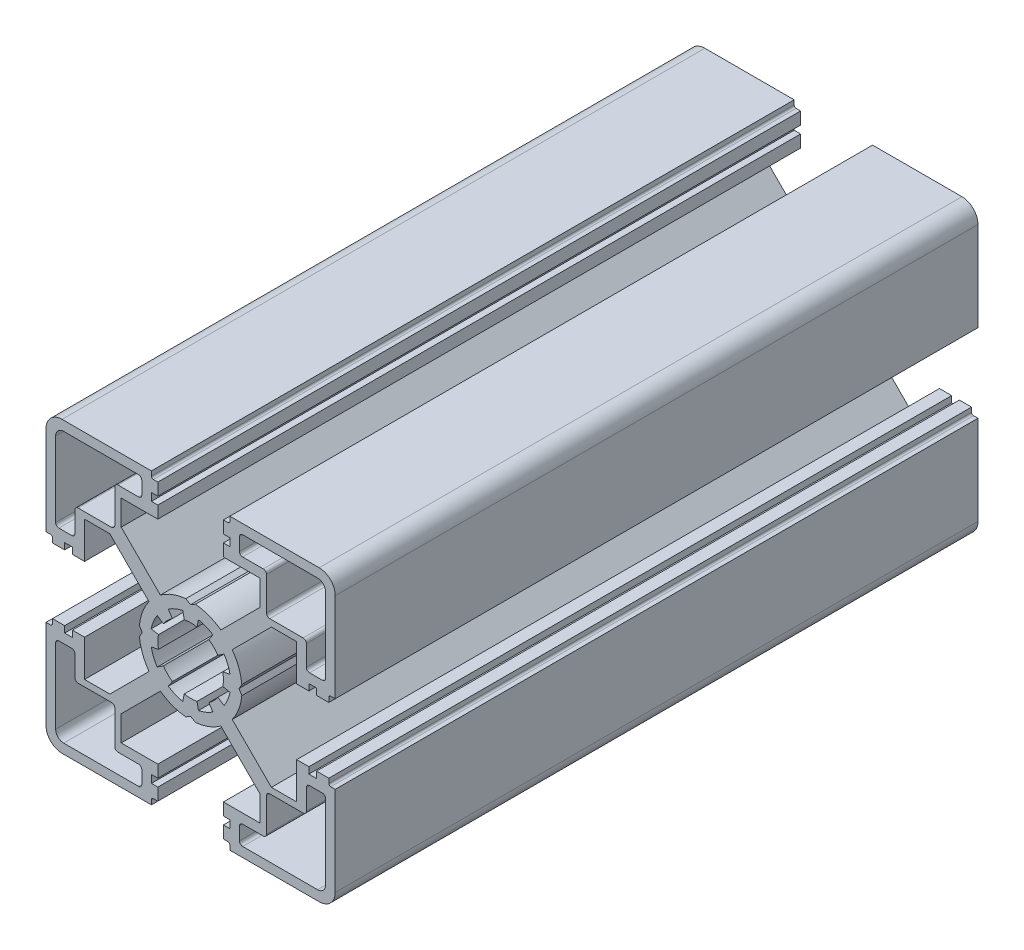
from build123d import *

# Parameters (mm, degrees)
EXTRUDE_1_DEPTH = 100


with BuildPart() as part:
    # 草图1 → 凸台-拉伸1 (new body)
    with BuildSketch(Plane.XY):
        with BuildLine():
            Line((-5.371587854, 21.742987377), (-19.271587854, 21.742987377))
            ThreePointArc((-19.271587854, 21.742987377), (-21.039354807, 21.01075433), (-21.771587854, 19.242987377))
            Line((-21.771587854, 19.242987377), (-21.771587854, 5.342987377))
            Line((-21.771587854, 5.342987377), (-21.071587854, 5.342987377))
            ThreePointArc((-21.071587854, 5.342987377), (-20.85945582, 5.255119412), (-20.771587854, 5.042987377))
            Line((-20.771587854, 5.042987377), (-20.771587854, 4.342987377))
            Line((-20.771587854, 4.342987377), (-18.871587854, 4.342987377))
            Line((-18.871587854, 4.342987377), (-18.871587854, 5.342987377))
            Line((-18.871587854, 5.342987377), (-17.671587854, 5.342987377))
            Line((-17.671587854, 5.342987377), (-17.671587854, 4.342987377))
            Line((-17.671587854, 4.342987377), (-15.771587854, 4.342987377))
            Line((-15.771587854, 4.342987377), (-15.771587854, 10.042987377))
            Line((-15.771587854, 10.042987377), (-11.839354807, 10.042987377))
            Line((-11.839354807, 10.042987377), (-5.74284549, 3.94647806))
            ThreePointArc((-5.74284549, 3.94647806), (-6.755384879, 2.070138255), (-7.236354015, -0.007012623))
            Line((-7.236354015, -0.007012623), (-6.803341313, -0.757012623))
            Line((-6.803341313, -0.757012623), (-7.236354015, -1.507012623))
            ThreePointArc((-7.236354015, -1.507012623), (-6.755384879, -3.584163501), (-5.74284549, -5.460503306))
            Line((-5.74284549, -5.460503306), (-11.839354807, -11.557012623))
            Line((-11.839354807, -11.557012623), (-15.771587854, -11.557012623))
            Line((-15.771587854, -11.557012623), (-15.771587854, -5.857012623))
            Line((-15.771587854, -5.857012623), (-17.671587854, -5.857012623))
            Line((-17.671587854, -5.857012623), (-17.671587854, -6.857012623))
            Line((-17.671587854, -6.857012623), (-18.871587854, -6.857012623))
            Line((-18.871587854, -6.857012623), (-18.871587854, -5.857012623))
            Line((-18.871587854, -5.857012623), (-20.771587854, -5.857012623))
            Line((-20.771587854, -5.857012623), (-20.771587854, -6.557012623))
            ThreePointArc((-20.771587854, -6.557012623), (-20.85945582, -6.769144657), (-21.071587854, -6.857012623))
            Line((-21.071587854, -6.857012623), (-21.771587854, -6.857012623))
            Line((-21.771587854, -6.857012623), (-21.771587854, -20.757012623))
            ThreePointArc((-21.771587854, -20.757012623), (-21.039354807, -22.524779576), (-19.271587854, -23.257012623))
            Line((-19.271587854, -23.257012623), (-5.371587854, -23.257012623))
            Line((-5.371587854, -23.257012623), (-5.371587854, -22.557012623))
            ThreePointArc((-5.371587854, -22.557012623), (-5.283719889, -22.344880588), (-5.071587854, -22.257012623))
            Line((-5.071587854, -22.257012623), (-4.371587854, -22.257012623))
            Line((-4.371587854, -22.257012623), (-4.371587854, -20.357012623))
            Line((-4.371587854, -20.357012623), (-5.371587854, -20.357012623))
            Line((-5.371587854, -20.357012623), (-5.371587854, -19.157012623))
            Line((-5.371587854, -19.157012623), (-4.371587854, -19.157012623))
            Line((-4.371587854, -19.157012623), (-4.371587854, -17.257012623))
            Line((-4.371587854, -17.257012623), (-10.071587854, -17.257012623))
            Line((-10.071587854, -17.257012623), (-10.071587854, -13.324779576))
            Line((-10.071587854, -13.324779576), (-3.975078537, -7.228270259))
            ThreePointArc((-3.975078537, -7.228270259), (-2.098738732, -8.240809648), (-0.021587854, -8.721778784))
            Line((-0.021587854, -8.721778784), (0.728412146, -8.288766082))
            Line((0.728412146, -8.288766082), (1.478412146, -8.721778784))
            ThreePointArc((1.478412146, -8.721778784), (3.555563024, -8.240809648), (5.431902829, -7.228270259))
            Line((5.431902829, -7.228270259), (11.528412146, -13.324779576))
            Line((11.528412146, -13.324779576), (11.528412146, -17.257012623))
            Line((11.528412146, -17.257012623), (5.828412146, -17.257012623))
            Line((5.828412146, -17.257012623), (5.828412146, -19.157012623))
            Line((5.828412146, -19.157012623), (6.828412146, -19.157012623))
            Line((6.828412146, -19.157012623), (6.828412146, -20.357012623))
            Line((6.828412146, -20.357012623), (5.828412146, -20.357012623))
            Line((5.828412146, -20.357012623), (5.828412146, -22.257012623))
            Line((5.828412146, -22.257012623), (6.528412146, -22.257012623))
            ThreePointArc((6.528412146, -22.257012623), (6.74054418, -22.344880588), (6.828412146, -22.557012623))
            Line((6.828412146, -22.557012623), (6.828412146, -23.257012623))
            Line((6.828412146, -23.257012623), (20.728412146, -23.257012623))
            ThreePointArc((20.728412146, -23.257012623), (22.496179099, -22.524779576), (23.228412146, -20.757012623))
            Line((23.228412146, -20.757012623), (23.228412146, -6.857012623))
            Line((23.228412146, -6.857012623), (22.528412146, -6.857012623))
            ThreePointArc((22.528412146, -6.857012623), (22.316280111, -6.769144657), (22.228412146, -6.557012623))
            Line((22.228412146, -6.557012623), (22.228412146, -5.857012623))
            Line((22.228412146, -5.857012623), (20.328412146, -5.857012623))
            Line((20.328412146, -5.857012623), (20.328412146, -6.857012623))
            Line((20.328412146, -6.857012623), (19.128412146, -6.857012623))
            Line((19.128412146, -6.857012623), (19.128412146, -5.857012623))
            Line((19.128412146, -5.857012623), (17.228412146, -5.857012623))
            Line((17.228412146, -5.857012623), (17.228412146, -11.557012623))
            Line((17.228412146, -11.557012623), (13.296179099, -11.557012623))
            Line((13.296179099, -11.557012623), (7.199669782, -5.460503306))
            ThreePointArc((7.199669782, -5.460503306), (8.212209171, -3.584163501), (8.693178307, -1.507012623))
            Line((8.693178307, -1.507012623), (8.260165605, -0.757012623))
            Line((8.260165605, -0.757012623), (8.693178307, -0.007012623))
            ThreePointArc((8.693178307, -0.007012623), (8.212209171, 2.070138255), (7.199669782, 3.94647806))
            Line((7.199669782, 3.94647806), (13.296179099, 10.042987377))
            Line((13.296179099, 10.042987377), (17.228412146, 10.042987377))
            Line((17.228412146, 10.042987377), (17.228412146, 4.342987377))
            Line((17.228412146, 4.342987377), (19.128412146, 4.342987377))
            Line((19.128412146, 4.342987377), (19.128412146, 5.342987377))
            Line((19.128412146, 5.342987377), (20.328412146, 5.342987377))
            Line((20.328412146, 5.342987377), (20.328412146, 4.342987377))
            Line((20.328412146, 4.342987377), (22.228412146, 4.342987377))
            Line((22.228412146, 4.342987377), (22.228412146, 5.042987377))
            ThreePointArc((22.228412146, 5.042987377), (22.316280111, 5.255119412), (22.528412146, 5.342987377))
            Line((22.528412146, 5.342987377), (23.228412146, 5.342987377))
            Line((23.228412146, 5.342987377), (23.228412146, 19.242987377))
            ThreePointArc((23.228412146, 19.242987377), (22.496179099, 21.01075433), (20.728412146, 21.742987377))
            Line((20.728412146, 21.742987377), (6.828412146, 21.742987377))
            Line((6.828412146, 21.742987377), (6.828412146, 21.042987377))
            ThreePointArc((6.828412146, 21.042987377), (6.74054418, 20.830855343), (6.528412146, 20.742987377))
            Line((6.528412146, 20.742987377), (5.828412146, 20.742987377))
            Line((5.828412146, 20.742987377), (5.828412146, 18.842987377))
            Line((5.828412146, 18.842987377), (6.828412146, 18.842987377))
            Line((6.828412146, 18.842987377), (6.828412146, 17.642987377))
            Line((6.828412146, 17.642987377), (5.828412146, 17.642987377))
            Line((5.828412146, 17.642987377), (5.828412146, 15.742987377))
            Line((5.828412146, 15.742987377), (11.528412146, 15.742987377))
            Line((11.528412146, 15.742987377), (11.528412146, 11.81075433))
            Line((11.528412146, 11.81075433), (5.431902829, 5.714245013))
            ThreePointArc((5.431902829, 5.714245013), (3.555563024, 6.726784402), (1.478412146, 7.207753538))
            Line((1.478412146, 7.207753538), (0.728412146, 6.774740836))
            Line((0.728412146, 6.774740836), (-0.021587854, 7.207753538))
            ThreePointArc((-0.021587854, 7.207753538), (-2.098738732, 6.726784402), (-3.975078537, 5.714245013))
            Line((-3.975078537, 5.714245013), (-10.071587854, 11.81075433))
            Line((-10.071587854, 11.81075433), (-10.071587854, 15.742987377))
            Line((-10.071587854, 15.742987377), (-4.371587854, 15.742987377))
            Line((-4.371587854, 15.742987377), (-4.371587854, 17.642987377))
            Line((-4.371587854, 17.642987377), (-5.371587854, 17.642987377))
            Line((-5.371587854, 17.642987377), (-5.371587854, 18.842987377))
            Line((-5.371587854, 18.842987377), (-4.371587854, 18.842987377))
            Line((-4.371587854, 18.842987377), (-4.371587854, 20.742987377))
            Line((-4.371587854, 20.742987377), (-5.071587854, 20.742987377))
            ThreePointArc((-5.071587854, 20.742987377), (-5.283719889, 20.830855343), (-5.371587854, 21.042987377))
            Line((-5.371587854, 21.042987377), (-5.371587854, 21.742987377))
        make_face()
        with BuildLine():
            Line((-19.771587854, 6.842987377), (-17.771587854, 6.842987377))
            ThreePointArc((-17.771587854, 6.842987377), (-17.418034464, 6.989433987), (-17.271587854, 7.342987377))
            Line((-17.271587854, 7.342987377), (-17.271587854, 10.542987377))
            ThreePointArc((-17.271587854, 10.542987377), (-17.125141245, 10.896540768), (-16.771587854, 11.042987377))
            Line((-16.771587854, 11.042987377), (-11.571587854, 11.042987377))
            ThreePointArc((-11.571587854, 11.042987377), (-11.218034464, 11.189433987), (-11.071587854, 11.542987377))
            Line((-11.071587854, 11.542987377), (-11.071587854, 16.742987377))
            ThreePointArc((-11.071587854, 16.742987377), (-10.925141245, 17.096540768), (-10.571587854, 17.242987377))
            Line((-10.571587854, 17.242987377), (-7.371587854, 17.242987377))
            ThreePointArc((-7.371587854, 17.242987377), (-7.018034464, 17.389433987), (-6.871587854, 17.742987377))
            Line((-6.871587854, 17.742987377), (-6.871587854, 19.742987377))
            ThreePointArc((-6.871587854, 19.742987377), (-7.018034464, 20.096540768), (-7.371587854, 20.242987377))
            Line((-7.371587854, 20.242987377), (-19.021587854, 20.242987377))
            ThreePointArc((-19.021587854, 20.242987377), (-19.905471331, 19.876870854), (-20.271587854, 18.992987377))
            Line((-20.271587854, 18.992987377), (-20.271587854, 7.342987377))
            ThreePointArc((-20.271587854, 7.342987377), (-20.125141245, 6.989433987), (-19.771587854, 6.842987377))
        make_face(mode=Mode.SUBTRACT)
        with BuildLine():
            Line((19.228412146, -8.357012623), (21.228412146, -8.357012623))
            ThreePointArc((21.228412146, -8.357012623), (21.581965536, -8.503459232), (21.728412146, -8.857012623))
            Line((21.728412146, -8.857012623), (21.728412146, -20.507012623))
            ThreePointArc((21.728412146, -20.507012623), (21.362295622, -21.390896099), (20.478412146, -21.757012623))
            Line((20.478412146, -21.757012623), (8.828412146, -21.757012623))
            ThreePointArc((8.828412146, -21.757012623), (8.474858755, -21.610566013), (8.328412146, -21.257012623))
            Line((8.328412146, -21.257012623), (8.328412146, -19.257012623))
            ThreePointArc((8.328412146, -19.257012623), (8.474858755, -18.903459232), (8.828412146, -18.757012623))
            Line((8.828412146, -18.757012623), (12.028412146, -18.757012623))
            ThreePointArc((12.028412146, -18.757012623), (12.381965536, -18.610566013), (12.528412146, -18.257012623))
            Line((12.528412146, -18.257012623), (12.528412146, -13.057012623))
            ThreePointArc((12.528412146, -13.057012623), (12.674858755, -12.703459232), (13.028412146, -12.557012623))
            Line((13.028412146, -12.557012623), (18.228412146, -12.557012623))
            ThreePointArc((18.228412146, -12.557012623), (18.581965536, -12.410566013), (18.728412146, -12.057012623))
            Line((18.728412146, -12.057012623), (18.728412146, -8.857012623))
            ThreePointArc((18.728412146, -8.857012623), (18.874858755, -8.503459232), (19.228412146, -8.357012623))
        make_face(mode=Mode.SUBTRACT)
        with BuildLine():
            Line((21.228412146, 6.842987377), (19.228412146, 6.842987377))
            ThreePointArc((19.228412146, 6.842987377), (18.874858755, 6.989433987), (18.728412146, 7.342987377))
            Line((18.728412146, 7.342987377), (18.728412146, 10.542987377))
            ThreePointArc((18.728412146, 10.542987377), (18.581965536, 10.896540768), (18.228412146, 11.042987377))
            Line((18.228412146, 11.042987377), (13.028412146, 11.042987377))
            ThreePointArc((13.028412146, 11.042987377), (12.674858755, 11.189433987), (12.528412146, 11.542987377))
            Line((12.528412146, 11.542987377), (12.528412146, 16.742987377))
            ThreePointArc((12.528412146, 16.742987377), (12.381965536, 17.096540768), (12.028412146, 17.242987377))
            Line((12.028412146, 17.242987377), (8.828412146, 17.242987377))
            ThreePointArc((8.828412146, 17.242987377), (8.474858755, 17.389433987), (8.328412146, 17.742987377))
            Line((8.328412146, 17.742987377), (8.328412146, 19.742987377))
            ThreePointArc((8.328412146, 19.742987377), (8.474858755, 20.096540768), (8.828412146, 20.242987377))
            Line((8.828412146, 20.242987377), (20.478412146, 20.242987377))
            ThreePointArc((20.478412146, 20.242987377), (21.362295622, 19.876870854), (21.728412146, 18.992987377))
            Line((21.728412146, 18.992987377), (21.728412146, 7.342987377))
            ThreePointArc((21.728412146, 7.342987377), (21.581965536, 6.989433987), (21.228412146, 6.842987377))
        make_face(mode=Mode.SUBTRACT)
        with BuildLine():
            Line((-19.771587854, -8.357012623), (-17.771587854, -8.357012623))
            ThreePointArc((-17.771587854, -8.357012623), (-17.418034464, -8.503459232), (-17.271587854, -8.857012623))
            Line((-17.271587854, -8.857012623), (-17.271587854, -12.057012623))
            ThreePointArc((-17.271587854, -12.057012623), (-17.125141245, -12.410566013), (-16.771587854, -12.557012623))
            Line((-16.771587854, -12.557012623), (-11.571587854, -12.557012623))
            ThreePointArc((-11.571587854, -12.557012623), (-11.218034464, -12.703459232), (-11.071587854, -13.057012623))
            Line((-11.071587854, -13.057012623), (-11.071587854, -18.257012623))
            ThreePointArc((-11.071587854, -18.257012623), (-10.925141245, -18.610566013), (-10.571587854, -18.757012623))
            Line((-10.571587854, -18.757012623), (-7.371587854, -18.757012623))
            ThreePointArc((-7.371587854, -18.757012623), (-7.018034464, -18.903459232), (-6.871587854, -19.257012623))
            Line((-6.871587854, -19.257012623), (-6.871587854, -21.257012623))
            ThreePointArc((-6.871587854, -21.257012623), (-7.018034464, -21.610566013), (-7.371587854, -21.757012623))
            Line((-7.371587854, -21.757012623), (-19.021587854, -21.757012623))
            ThreePointArc((-19.021587854, -21.757012623), (-19.905471331, -21.390896099), (-20.271587854, -20.507012623))
            Line((-20.271587854, -20.507012623), (-20.271587854, -8.857012623))
            ThreePointArc((-20.271587854, -8.857012623), (-20.125141245, -8.503459232), (-19.771587854, -8.357012623))
        make_face(mode=Mode.SUBTRACT)
        with BuildLine():
            Line((-2.743901811, -5.9536977), (-2.104996043, -4.997507645))
            ThreePointArc((-2.104996043, -4.997507645), (-2.877832438, -4.363257207), (-3.512082877, -3.590420811))
            Line((-3.512082877, -3.590420811), (-4.468272931, -4.229326579))
            ThreePointArc((-4.468272931, -4.229326579), (-5.045834932, -3.148784075), (-5.401495857, -1.976327135))
            Line((-5.401495857, -1.976327135), (-4.273592784, -1.751973265))
            ThreePointArc((-4.273592784, -1.751973265), (-4.371587854, -0.757012623), (-4.273592784, 0.23794802))
            Line((-4.273592784, 0.23794802), (-5.401495857, 0.46230189))
            ThreePointArc((-5.401495857, 0.46230189), (-5.045834932, 1.63475883), (-4.468272931, 2.715301334))
            Line((-4.468272931, 2.715301334), (-3.512082877, 2.076395566))
            ThreePointArc((-3.512082877, 2.076395566), (-2.877832438, 2.849231961), (-2.104996043, 3.4834824))
            Line((-2.104996043, 3.4834824), (-2.743901811, 4.439672454))
            ThreePointArc((-2.743901811, 4.439672454), (-1.663359306, 5.017234455), (-0.490902367, 5.37289538))
            Line((-0.490902367, 5.37289538), (-0.266548496, 4.244992307))
            ThreePointArc((-0.266548496, 4.244992307), (0.728412146, 4.342987377), (1.723372788, 4.244992307))
            Line((1.723372788, 4.244992307), (1.947726658, 5.37289538))
            ThreePointArc((1.947726658, 5.37289538), (3.120183598, 5.017234455), (4.200726102, 4.439672454))
            Line((4.200726102, 4.439672454), (3.561820334, 3.4834824))
            ThreePointArc((3.561820334, 3.4834824), (4.33465673, 2.849231961), (4.968907169, 2.076395566))
            Line((4.968907169, 2.076395566), (5.925097223, 2.715301334))
            ThreePointArc((5.925097223, 2.715301334), (6.502659224, 1.63475883), (6.858320148, 0.46230189))
            Line((6.858320148, 0.46230189), (5.730417076, 0.23794802))
            ThreePointArc((5.730417076, 0.23794802), (5.828412146, -0.757012623), (5.730417076, -1.751973265))
            Line((5.730417076, -1.751973265), (6.858320148, -1.976327135))
            ThreePointArc((6.858320148, -1.976327135), (6.502659224, -3.148784075), (5.925097223, -4.229326579))
            Line((5.925097223, -4.229326579), (4.968907169, -3.590420811))
            ThreePointArc((4.968907169, -3.590420811), (4.33465673, -4.363257207), (3.561820334, -4.997507645))
            Line((3.561820334, -4.997507645), (4.200726102, -5.9536977))
            ThreePointArc((4.200726102, -5.9536977), (3.120183598, -6.531259701), (1.947726658, -6.886920625))
            Line((1.947726658, -6.886920625), (1.723372788, -5.759017553))
            ThreePointArc((1.723372788, -5.759017553), (0.728412146, -5.857012623), (-0.266548496, -5.759017553))
            Line((-0.266548496, -5.759017553), (-0.490902367, -6.886920625))
            ThreePointArc((-0.490902367, -6.886920625), (-1.663359306, -6.531259701), (-2.743901811, -5.9536977))
        make_face(mode=Mode.SUBTRACT)
    extrude(amount=EXTRUDE_1_DEPTH)


solid = part.part
